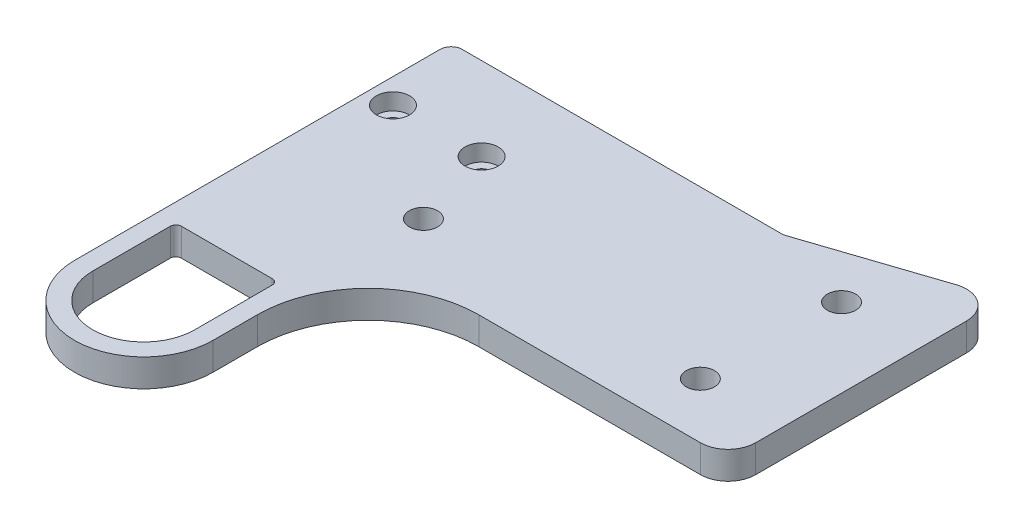
from build123d import *

# Parameters (mm, degrees)
SKETCH_1_R          = 2.55
SKETCH_1_R_2        = 7.5
EXTRUDE_1_DEPTH     = 5
FILLET_1_R          = 20
FILLET_2_R          = 5
CUT_EXTRUDE_1_DEPTH = 109.559891304
EXTRUDE_2_DEPTH     = 5
SKETCH_3_R          = 1.55
CUT_EXTRUDE_2_DEPTH = 109.559891304
FILLET_3_R          = 2
SKETCH_5_R          = 3
CUT_EXTRUDE_3_DEPTH = 3


with BuildPart() as part:
    # ｽｹｯﾁ1 → ﾎﾞｽ - 押し出し1 (new body)
    with BuildSketch(Plane(origin=(0, 0, 0), x_dir=(1, 0, 0), z_dir=(0, 1, 0))):
        with BuildLine():
            Line((0, 0), (0, -48))
            ThreePointArc((0, -48), (12.5, -60.5), (25, -48))
            Line((25, -48), (25, -20))
            Line((25, -20), (90, -20))
            Line((90, -20), (90, 30))
            Line((90, 30), (0, 0))
        make_face()
        with Locations(Location((75.769750529, 14.715657976, 0), (0, 0, 270))):
            Circle(SKETCH_1_R, mode=Mode.SUBTRACT)
        with Locations(Location((75, -10, 0), (0, 0, 270))):
            Circle(SKETCH_1_R, mode=Mode.SUBTRACT)
        with Locations(Location((25, -10, 0), (0, 0, 270))):
            Circle(SKETCH_1_R, mode=Mode.SUBTRACT)
        with Locations(Location((12.5, -48, 0), (0, 0, 270))):
            Circle(SKETCH_1_R_2, mode=Mode.SUBTRACT)
    extrude(amount=EXTRUDE_1_DEPTH)

    # ﾌｨﾚｯﾄ1
    fillet_1_edges = [part.edges().sort_by_distance(p)[0] for p in [
        (25, 2.5, 20),
    ]]
    fillet(fillet_1_edges, radius=FILLET_1_R)

    # ﾌｨﾚｯﾄ2
    fillet_2_edges = [part.edges().sort_by_distance(p)[0] for p in [
        (90, 2.5, -30),
        (90, 2.5, 20),
    ]]
    fillet(fillet_2_edges, radius=FILLET_2_R)

    # ｽｹｯﾁ2 → ｶｯﾄ - 押し出し1 (cut, through all)
    with BuildSketch(Plane(origin=(0, 5, 0), x_dir=(1, 0, 0), z_dir=(0, 1, 0))):
        with BuildLine():
            Line((3.3, -48), (3.3, -34))
            ThreePointArc((3.3, -34), (3.592893219, -33.292893219), (4.3, -33))
            Line((4.3, -33), (20.7, -33))
            ThreePointArc((20.7, -33), (21.407106781, -33.292893219), (21.7, -34))
            Line((21.7, -34), (21.7, -48))
            ThreePointArc((21.7, -48), (12.5, -57.2), (3.3, -48))
        make_face()
    extrude(amount=-CUT_EXTRUDE_1_DEPTH, mode=Mode.SUBTRACT)

    # ｽｹｯﾁ4 → ﾎﾞｽ - 押し出し2 (add)
    with BuildSketch(Plane(origin=(0, 5, 0), x_dir=(1, 0, 0), z_dir=(0, 1, 0))):
        Polygon((0, 0), (0, 20), (60, 20), align=None)
    extrude(amount=-EXTRUDE_2_DEPTH)

    # ｽｹｯﾁ3 → ｶｯﾄ - 押し出し2 (cut, through all)
    with BuildSketch(Plane(origin=(0, 5, 0), x_dir=(1, 0, 0), z_dir=(0, 1, 0))):
        with Locations(Location((20.5, 5, 0), (0, 0, 270))):
            Circle(SKETCH_3_R)
        with Locations(Location((4.5, 5, 0), (0, 0, 90))):
            Circle(SKETCH_3_R)
    extrude(amount=-CUT_EXTRUDE_2_DEPTH, mode=Mode.SUBTRACT)

    # ﾌｨﾚｯﾄ3
    fillet_3_edges = [part.edges().sort_by_distance(p)[0] for p in [
        (60, 2.5, -20),
        (0, 2.5, -20),
    ]]
    fillet(fillet_3_edges, radius=FILLET_3_R)

    # ｽｹｯﾁ5 → ｶｯﾄ - 押し出し3 (cut)
    with BuildSketch(Plane.XZ.offset(-5)):
        with Locations(Location((4.5, -5, 0), (0, 0, 270))):
            Circle(SKETCH_5_R)
        with Locations(Location((20.5, -5, 0), (0, 0, 270))):
            Circle(SKETCH_5_R)
    extrude(amount=CUT_EXTRUDE_3_DEPTH, mode=Mode.SUBTRACT)


solid = part.part
